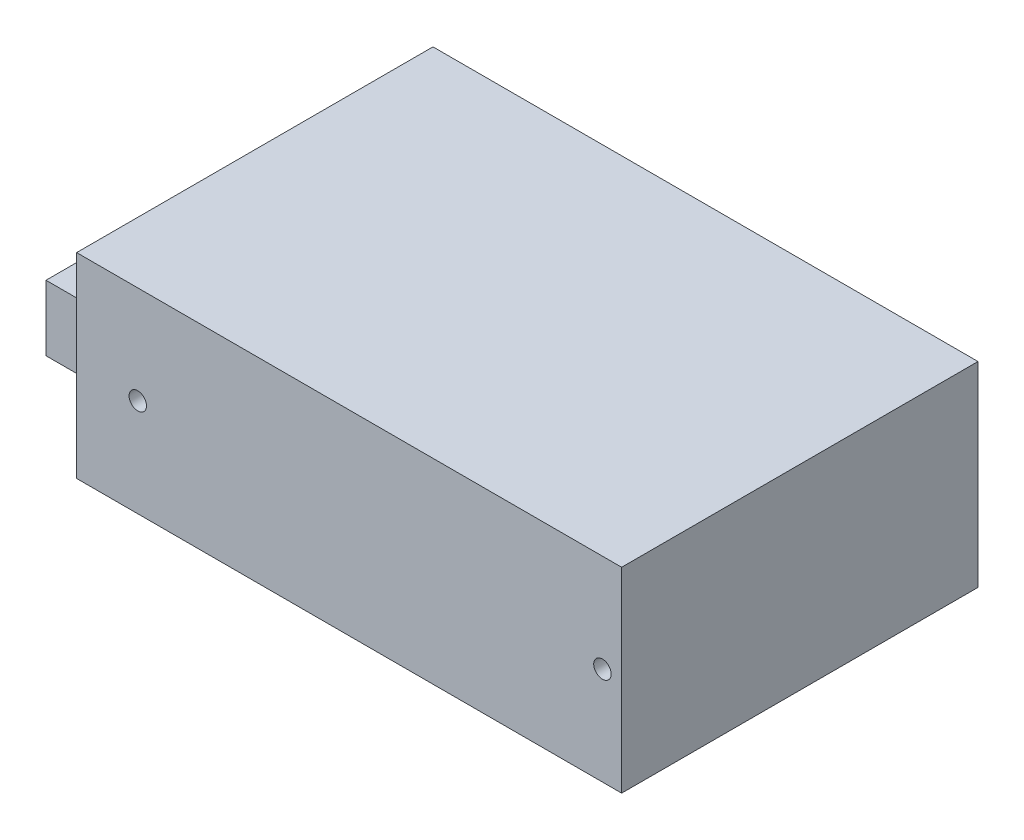
from build123d import *

# Parameters (mm, degrees)
SKETCH_1_W            = 78
SKETCH_1_H            = 51
EXTRUDE_1_DEPTH       = 28
HOLE_WIZARD_M31_D     = 2.5
HOLE_WIZARD_M31_DEPTH = 5.5
HOLE_WIZARD_M31_TIP   = 0.751075774
HOLE_WIZARD_M32_D     = 2.5
HOLE_WIZARD_M32_DEPTH = 5.5
HOLE_WIZARD_M32_TIP   = 0.751075774
SKETCH_6_W            = 36.55514342
SKETCH_6_H            = 9.362324501
EXTRUDE_2_DEPTH       = 14


with BuildPart() as part:
    # Эскиз1 → Бобышка-Вытянуть1 (new body)
    with BuildSketch(Plane(origin=(0, 0, 0), x_dir=(1, 0, 0), z_dir=(0, 1, 0))):
        Rectangle(SKETCH_1_W, SKETCH_1_H)
    extrude(amount=EXTRUDE_1_DEPTH)

    # Отверстие обработанное метчиком M31
    with Locations(Plane.XY.offset(25.5)):
        with Locations((36.25, 14), (-30.25, 14)):
            Hole(HOLE_WIZARD_M31_D / 2, depth=HOLE_WIZARD_M31_DEPTH)
            with Locations((0, 0, -(HOLE_WIZARD_M31_DEPTH + HOLE_WIZARD_M31_TIP / 2))):  # 118° drill point
                Cone(0, HOLE_WIZARD_M31_D / 2, HOLE_WIZARD_M31_TIP, mode=Mode.SUBTRACT)

    # Отверстие обработанное метчиком M32
    with Locations(Plane(origin=(0, 0, 0), x_dir=(-1, 0, 0), z_dir=(0, -1, 0))):
        with Locations((-28, -0.1), (27, -0.1)):
            Hole(HOLE_WIZARD_M32_D / 2, depth=HOLE_WIZARD_M32_DEPTH)
            with Locations((0, 0, -(HOLE_WIZARD_M32_DEPTH + HOLE_WIZARD_M32_TIP / 2))):  # 118° drill point
                Cone(0, HOLE_WIZARD_M32_D / 2, HOLE_WIZARD_M32_TIP, mode=Mode.SUBTRACT)

    # Эскиз6 → Бобышка-Вытянуть2 (add)
    with BuildSketch(Plane.ZY.offset(39)):
        with Locations((-2.393178454, 8.082800526)):
            Rectangle(SKETCH_6_W, SKETCH_6_H)
    extrude(amount=EXTRUDE_2_DEPTH)


solid = part.part
